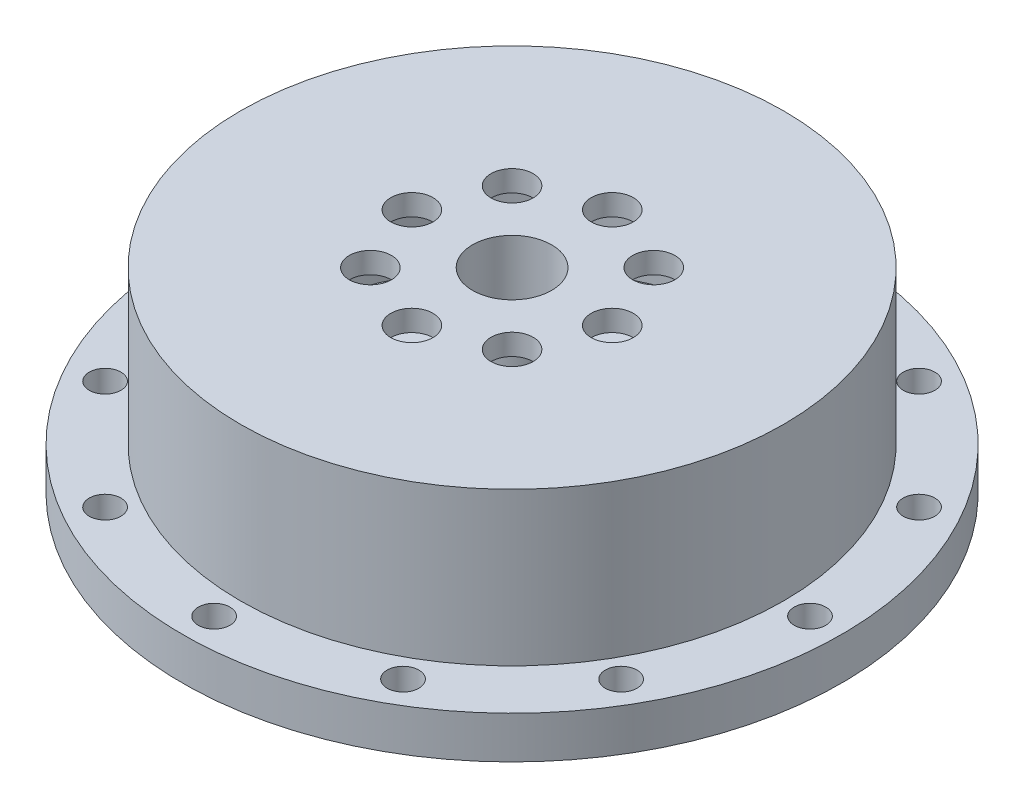
from build123d import *

# Parameters (mm, degrees)
SKETCH4_R           = 3
CUT_EXTRUDE1_DEPTH  = 10
SKETCH5_R           = 4
CUT_EXTRUDE2_DEPTH  = 10
SKETCH6_W           = 2
SKETCH6_H           = 3
BOSS_EXTRUDE1_DEPTH = 6


with BuildPart() as part:
    # Sketch1 → Revolve1 (revolve)
    with BuildSketch(Plane.XY, mode=Mode.PRIVATE) as revolve1_sk:
        Polygon((10.5, 32.216109623), (10.5, 39.216109623), (48, 39.216109623), (48, 9.216109623), (7.5, 9.216109623), (7.5, 3.216109623), (10, 3.216109623), (10, 6.216109623), (36, 6.216109623), (36, 4.216109623), (39, 4.216109623), (39, 6.216109623), (62.5, 6.216109623), (62.5, 14.216109623), (51.5, 14.216109623), (51.5, 43.216109623), (7.5, 43.216109623), (7.5, 32.216109623), align=None)
    revolve(revolve1_sk.sketch.rotate(Axis((0, 0, 0), (0, 1, 0)), 90), axis=Axis((0, 0, 0), (0, 1, 0)))

    # Sketch4 → Cut-Extrude1 (cut)
    with BuildSketch(Plane(origin=(0, 14.216109623, 0), x_dir=(1, 0, 0), z_dir=(0, 1, 0))):
        with Locations(Location((56.5, 0, 0), (0, 0, 270))):
            Circle(SKETCH4_R)
        with Locations(Location((48.930435314, -28.25, 0), (0, 0, 270))):
            Circle(SKETCH4_R)
        with Locations(Location((28.25, -48.930435314, 0), (0, 0, 270))):
            Circle(SKETCH4_R)
        with Locations(Location((0, -56.5, 0), (0, 0, 270))):
            Circle(SKETCH4_R)
        with Locations(Location((-28.25, -48.930435314, 0), (0, 0, 270))):
            Circle(SKETCH4_R)
        with Locations(Location((-48.930435314, -28.25, 0), (0, 0, 270))):
            Circle(SKETCH4_R)
        with Locations(Location((-56.5, 0, 0), (0, 0, 270))):
            Circle(SKETCH4_R)
        with Locations(Location((-48.930435314, 28.25, 0), (0, 0, 270))):
            Circle(SKETCH4_R)
        with Locations(Location((-28.25, 48.930435314, 0), (0, 0, 270))):
            Circle(SKETCH4_R)
        with Locations(Location((0, 56.5, 0), (0, 0, 270))):
            Circle(SKETCH4_R)
        with Locations(Location((28.25, 48.930435314, 0), (0, 0, 270))):
            Circle(SKETCH4_R)
        with Locations(Location((48.930435314, 28.25, 0), (0, 0, 270))):
            Circle(SKETCH4_R)
    extrude(amount=-CUT_EXTRUDE1_DEPTH, mode=Mode.SUBTRACT)

    # Sketch5 → Cut-Extrude2 (cut)
    with BuildSketch(Plane(origin=(0, 43.216109623, 0), x_dir=(1, 0, 0), z_dir=(0, 1, 0))):
        with Locations(Location((19, 0, 0), (0, 0, 270))):
            Circle(SKETCH5_R)
        with Locations(Location((13.435028843, -13.435028843, 0), (0, 0, 270))):
            Circle(SKETCH5_R)
        with Locations(Location((0, -19, 0), (0, 0, 270))):
            Circle(SKETCH5_R)
        with Locations(Location((-13.435028843, -13.435028843, 0), (0, 0, 270))):
            Circle(SKETCH5_R)
        with Locations(Location((-19, 0, 0), (0, 0, 270))):
            Circle(SKETCH5_R)
        with Locations(Location((-13.435028843, 13.435028843, 0), (0, 0, 270))):
            Circle(SKETCH5_R)
        with Locations(Location((0, 19, 0), (0, 0, 270))):
            Circle(SKETCH5_R)
        with Locations(Location((13.435028843, 13.435028843, 0), (0, 0, 270))):
            Circle(SKETCH5_R)
    extrude(amount=-CUT_EXTRUDE2_DEPTH, mode=Mode.SUBTRACT)

    # Sketch6 → Boss-Extrude1 (add)
    with BuildSketch(Plane.XZ.offset(-3.216109623)):
        with Locations((0, 7.5)):
            Rectangle(SKETCH6_W, SKETCH6_H)
    extrude(amount=-BOSS_EXTRUDE1_DEPTH)


solid = part.part
